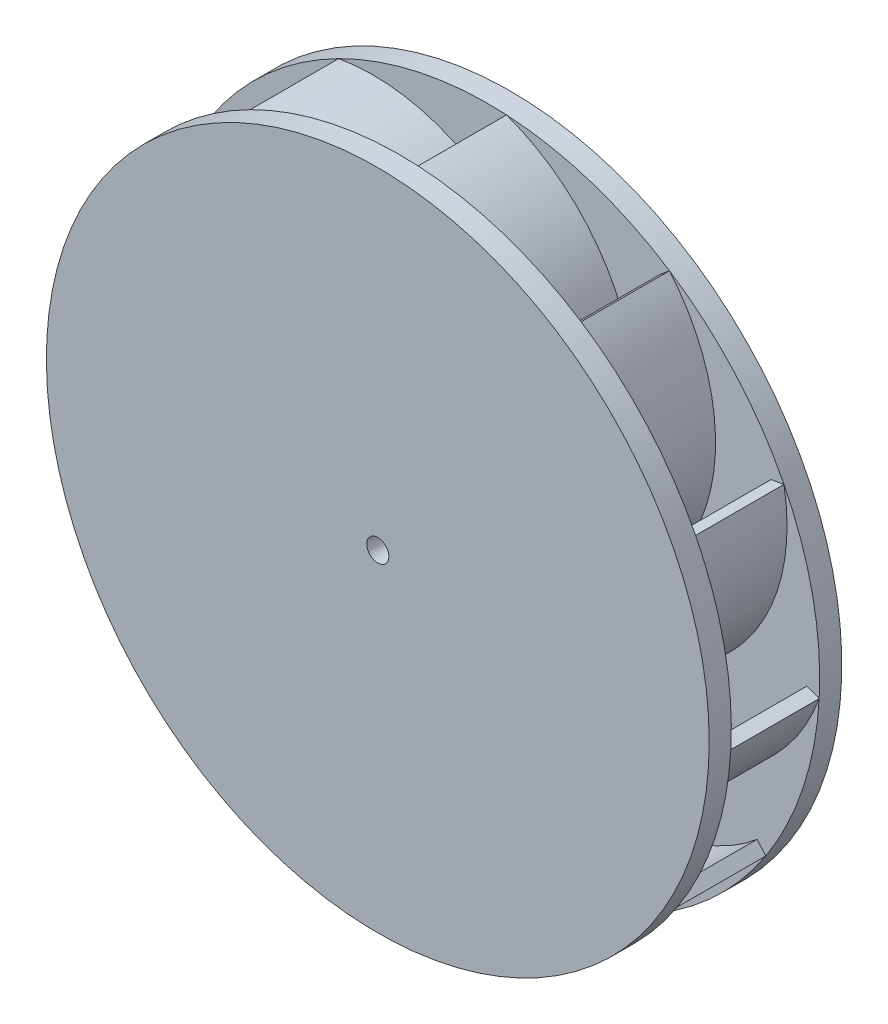
from build123d import *

# Parameters (mm, degrees)
SKETCH_1_R          = 15
EXTRUDE_1_DEPTH     = 1
EXTRUDE_4_DEPTH     = 5
SKETCH_3_R          = 2
EXTRUDE_2_DEPTH     = 4
FILLET_1_R          = 2
FILLET_2_R          = 1
SKETCH_4_R          = 0.5
CUT_EXTRUDE_1_DEPTH = 5
SKETCH_5_R          = 15
EXTRUDE_3_DEPTH     = 1
SKETCH_6_R          = 8
SKETCH_6_R_2        = 7.2
EXTRUDE_4_2_DEPTH   = 1
SKETCH_7_R          = 7.6
CUT_EXTRUDE_2_DEPTH = 1


with BuildPart() as part:
    # 草图1 → 凸台-拉伸1 (new body)
    with BuildSketch(Plane.XY):
        Circle(SKETCH_1_R)
    extrude(amount=EXTRUDE_1_DEPTH)

    # 草图2 → Extrude 4 (add)
    with BuildSketch(Plane(origin=(0, 0, 0), x_dir=(-1, 0, 0), z_dir=(0, 0, -1))):
        with BuildLine():
            ThreePointArc((0, 7), (6.025450773, 10.246079868), (12.557822256, 8.203724775))
            Line((12.557822256, 8.203724775), (12.170554132, 7.745441675))
            ThreePointArc((12.170554132, 7.745441675), (6.082701111, 9.648817447), (0.467273577, 6.623628635))
            Line((0.467273577, 6.623628635), (0, 7))
        make_face()
        with BuildLine():
            ThreePointArc((3.5, 6.062177826), (10.341233372, 5.860640068), (14.977255477, 0.825722933))
            Line((14.977255477, 0.825722933), (14.412729894, 0.622472188))
            ThreePointArc((14.412729894, 0.622472188), (10.092182409, 5.31477047), (3.716485105, 5.502593875))
            Line((3.716485105, 5.502593875), (3.5, 6.062177826))
        make_face()
        with BuildLine():
            ThreePointArc((6.062177826, 3.5), (11.886090841, -0.095153505), (13.383545189, -6.773530702))
            Line((13.383545189, -6.773530702), (12.79302632, -6.667288219))
            ThreePointArc((12.79302632, -6.667288219), (11.397471581, -0.443364962), (5.969867451, 2.907143529))
            Line((5.969867451, 2.907143529), (6.062177826, 3.5))
        make_face()
        with BuildLine():
            ThreePointArc((7, 0), (10.246079868, -6.025450773), (8.203724775, -12.557822256))
            Line((8.203724775, -12.557822256), (7.745441675, -12.170554132))
            ThreePointArc((7.745441675, -12.170554132), (9.648817447, -6.082701111), (6.623628635, -0.467273577))
            Line((6.623628635, -0.467273577), (7, 0))
        make_face()
        with BuildLine():
            ThreePointArc((6.062177826, -3.5), (5.860640068, -10.341233372), (0.825722933, -14.977255477))
            Line((0.825722933, -14.977255477), (0.622472188, -14.412729894))
            ThreePointArc((0.622472188, -14.412729894), (5.31477047, -10.092182409), (5.502593875, -3.716485105))
            Line((5.502593875, -3.716485105), (6.062177826, -3.5))
        make_face()
        with BuildLine():
            ThreePointArc((3.5, -6.062177826), (-0.095153505, -11.886090841), (-6.773530702, -13.383545189))
            Line((-6.773530702, -13.383545189), (-6.667288219, -12.79302632))
            ThreePointArc((-6.667288219, -12.79302632), (-0.443364962, -11.397471581), (2.907143529, -5.969867451))
            Line((2.907143529, -5.969867451), (3.5, -6.062177826))
        make_face()
        with BuildLine():
            ThreePointArc((0, -7), (-6.025450773, -10.246079868), (-12.557822256, -8.203724775))
            Line((-12.557822256, -8.203724775), (-12.170554132, -7.745441675))
            ThreePointArc((-12.170554132, -7.745441675), (-6.082701111, -9.648817447), (-0.467273577, -6.623628635))
            Line((-0.467273577, -6.623628635), (0, -7))
        make_face()
        with BuildLine():
            ThreePointArc((-3.5, -6.062177826), (-10.341233372, -5.860640068), (-14.977255477, -0.825722933))
            Line((-14.977255477, -0.825722933), (-14.412729894, -0.622472188))
            ThreePointArc((-14.412729894, -0.622472188), (-10.092182409, -5.31477047), (-3.716485105, -5.502593875))
            Line((-3.716485105, -5.502593875), (-3.5, -6.062177826))
        make_face()
        with BuildLine():
            ThreePointArc((-6.062177826, -3.5), (-11.886090841, 0.095153505), (-13.383545189, 6.773530702))
            Line((-13.383545189, 6.773530702), (-12.79302632, 6.667288219))
            ThreePointArc((-12.79302632, 6.667288219), (-11.397471581, 0.443364962), (-5.969867451, -2.907143529))
            Line((-5.969867451, -2.907143529), (-6.062177826, -3.5))
        make_face()
        with BuildLine():
            ThreePointArc((-7, 0), (-10.246079868, 6.025450773), (-8.203724775, 12.557822256))
            Line((-8.203724775, 12.557822256), (-7.745441675, 12.170554132))
            ThreePointArc((-7.745441675, 12.170554132), (-9.648817447, 6.082701111), (-6.623628635, 0.467273577))
            Line((-6.623628635, 0.467273577), (-7, 0))
        make_face()
        with BuildLine():
            ThreePointArc((-6.062177826, 3.5), (-5.860640068, 10.341233372), (-0.825722933, 14.977255477))
            Line((-0.825722933, 14.977255477), (-0.622472188, 14.412729894))
            ThreePointArc((-0.622472188, 14.412729894), (-5.31477047, 10.092182409), (-5.502593875, 3.716485105))
            Line((-5.502593875, 3.716485105), (-6.062177826, 3.5))
        make_face()
        with BuildLine():
            ThreePointArc((-3.5, 6.062177826), (0.095153505, 11.886090841), (6.773530702, 13.383545189))
            Line((6.773530702, 13.383545189), (6.667288219, 12.79302632))
            ThreePointArc((6.667288219, 12.79302632), (0.443364962, 11.397471581), (-2.907143529, 5.969867451))
            Line((-2.907143529, 5.969867451), (-3.5, 6.062177826))
        make_face()
    extrude(amount=EXTRUDE_4_DEPTH)

    # 草图3 → 凸台-拉伸2 (add)
    with BuildSketch(Plane(origin=(0, 0, 0), x_dir=(-1, 0, 0), z_dir=(0, 0, -1))):
        with Locations(Location((0, 0, 0), (0, 0, 180))):
            Circle(SKETCH_3_R)
    extrude(amount=EXTRUDE_2_DEPTH)

    # 圆角1
    fillet_1_edges = [part.edges().sort_by_distance(p)[0] for p in [
        (-2, 0, 0),
    ]]
    fillet(fillet_1_edges, radius=FILLET_1_R)

    # 圆角2
    fillet_2_edges = [part.edges().sort_by_distance(p)[0] for p in [
        (-2, 0, -4),
    ]]
    fillet(fillet_2_edges, radius=FILLET_2_R)

    # 草图4 → 切除-拉伸1 (cut)
    with BuildSketch(Plane.XY.offset(1)):
        Circle(SKETCH_4_R)
    extrude(amount=-CUT_EXTRUDE_1_DEPTH, mode=Mode.SUBTRACT)

    # 草图5 → 凸台-拉伸3 (add)
    with BuildSketch(Plane(origin=(0, 0, -5), x_dir=(-1, 0, 0), z_dir=(0, 0, -1))):
        with Locations(Location((0, 0, 0), (0, 0, 3.155624395))):
            Circle(SKETCH_5_R)
    extrude(amount=-EXTRUDE_3_DEPTH)

    # 草图6 → Extrude 4 2 (add)
    with BuildSketch(Plane(origin=(0, 0, -5), x_dir=(-1, 0, 0), z_dir=(0, 0, -1))):
        Circle(SKETCH_6_R)
        Circle(SKETCH_6_R_2, mode=Mode.SUBTRACT)
    extrude(amount=EXTRUDE_4_2_DEPTH)

    # 草图7 → 切除-拉伸2 (cut)
    with BuildSketch(Plane(origin=(0, 0, -5), x_dir=(-1, 0, 0), z_dir=(0, 0, -1))):
        Circle(SKETCH_7_R)
    extrude(amount=-CUT_EXTRUDE_2_DEPTH, mode=Mode.SUBTRACT)


solid = part.part
